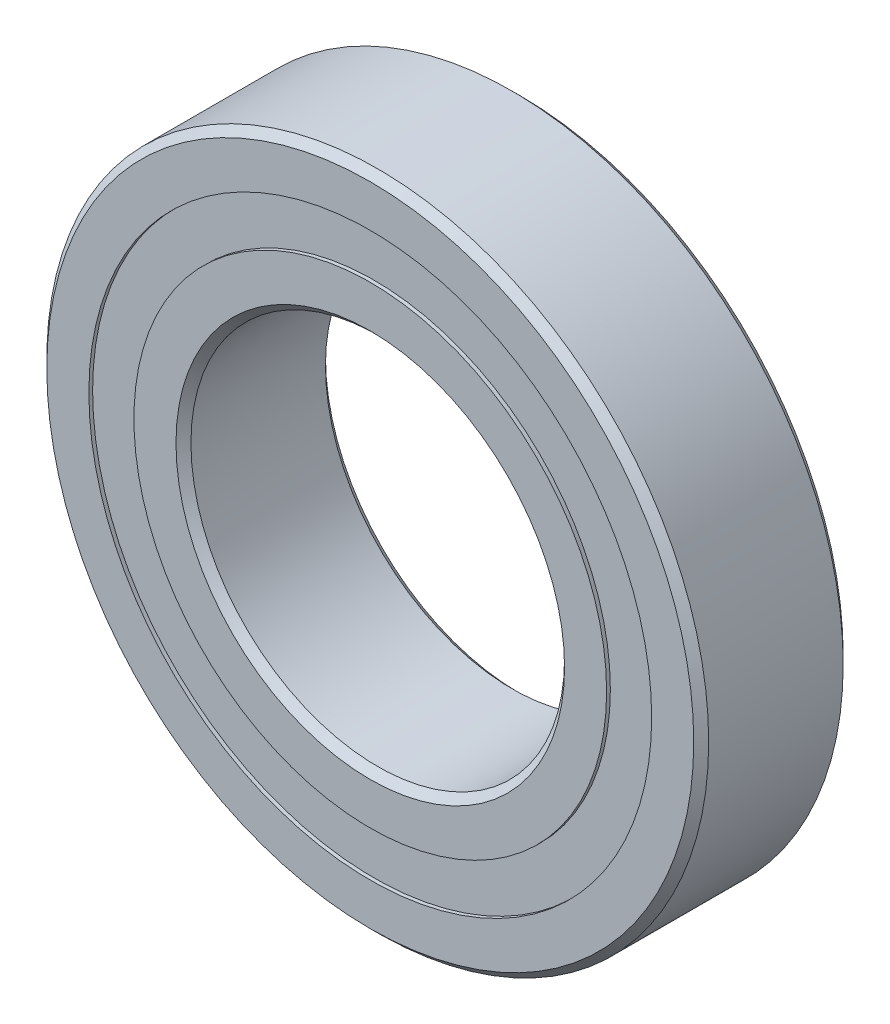
from build123d import *

# Parameters (mm, degrees)
CIRPATTERN1_COUNT = 12
SKETCH5_W         = 2.890924499
SKETCH5_H         = 4.21978022


with BuildPart() as part:
    # Sketch1 → Revolve1 (revolve)
    with BuildSketch(Plane(origin=(0, 0, 0), x_dir=(0, 0, -1), z_dir=(1, 0, 0))):
        with BuildLine():
            Line((6.3, 31), (-6.3, 31))
            Line((-6.3, 31), (-7, 30.3))
            Line((-7, 30.3), (-7, 26.35964011))
            Line((-7, 26.35964011), (-3.111111111, 26.35964011))
            ThreePointArc((-3.111111111, 26.35964011), (0, 28.008825501), (3.111111111, 26.35964011))
            Line((3.111111111, 26.35964011), (7, 26.35964011))
            Line((7, 26.35964011), (7, 30.3))
            Line((7, 30.3), (6.3, 31))
        make_face()
    revolve(axis=Axis((0, 0, 7), (0, 0, -1)))


with BuildPart() as body_2:
    # Sketch3 → Revolve3 (revolve)
    with BuildSketch(Plane(origin=(0, 0, 0), x_dir=(0, 0, -1), z_dir=(1, 0, 0))):
        with BuildLine():
            Line((-7, 22.13985989), (-3.111111111, 22.13985989))
            ThreePointArc((-3.111111111, 22.13985989), (0, 20.490674499), (3.111111111, 22.13985989))
            Line((3.111111111, 22.13985989), (7, 22.13985989))
            Line((7, 22.13985989), (7, 18.1995))
            Line((7, 18.1995), (6.3, 17.4995))
            Line((6.3, 17.4995), (-6.3, 17.4995))
            Line((-6.3, 17.4995), (-7, 18.1995))
            Line((-7, 18.1995), (-7, 22.13985989))
        make_face()
    revolve(axis=Axis((0, 0, 7), (0, 0, -1)))


with BuildPart() as body_3:
    # Sketch4 → Revolve4 (revolve)
    with BuildSketch(Plane(origin=(0, 0, 0), x_dir=(0, 0, -1), z_dir=(1, 0, 0))):
        with BuildLine():
            Line((-3.759075501, 24.24975), (3.759075501, 24.24975))
            ThreePointArc((3.759075501, 24.24975), (0, 28.008825501), (-3.759075501, 24.24975))
        make_face()
    revolve(axis=Axis((0, 24.24975, 3.759075501), (0, 0, -1)))


with BuildPart() as cirpattern1_1:
    # CirPattern1: pattern copy
    add(body_3.part.rotate(Axis((0, 0, -7), (0, 0, 1)), 1 * 360 / CIRPATTERN1_COUNT))


with BuildPart() as cirpattern1_2:
    # CirPattern1: pattern copy
    add(body_3.part.rotate(Axis((0, 0, -7), (0, 0, 1)), 2 * 360 / CIRPATTERN1_COUNT))


with BuildPart() as cirpattern1_3:
    # CirPattern1: pattern copy
    add(body_3.part.rotate(Axis((0, 0, -7), (0, 0, 1)), 3 * 360 / CIRPATTERN1_COUNT))


with BuildPart() as cirpattern1_4:
    # CirPattern1: pattern copy
    add(body_3.part.rotate(Axis((0, 0, -7), (0, 0, 1)), 4 * 360 / CIRPATTERN1_COUNT))


with BuildPart() as cirpattern1_5:
    # CirPattern1: pattern copy
    add(body_3.part.rotate(Axis((0, 0, -7), (0, 0, 1)), 5 * 360 / CIRPATTERN1_COUNT))


with BuildPart() as cirpattern1_6:
    # CirPattern1: pattern copy
    add(body_3.part.rotate(Axis((0, 0, -7), (0, 0, 1)), 6 * 360 / CIRPATTERN1_COUNT))


with BuildPart() as cirpattern1_7:
    # CirPattern1: pattern copy
    add(body_3.part.rotate(Axis((0, 0, -7), (0, 0, 1)), 7 * 360 / CIRPATTERN1_COUNT))


with BuildPart() as cirpattern1_8:
    # CirPattern1: pattern copy
    add(body_3.part.rotate(Axis((0, 0, -7), (0, 0, 1)), 8 * 360 / CIRPATTERN1_COUNT))


with BuildPart() as cirpattern1_9:
    # CirPattern1: pattern copy
    add(body_3.part.rotate(Axis((0, 0, -7), (0, 0, 1)), 9 * 360 / CIRPATTERN1_COUNT))


with BuildPart() as cirpattern1_10:
    # CirPattern1: pattern copy
    add(body_3.part.rotate(Axis((0, 0, -7), (0, 0, 1)), 10 * 360 / CIRPATTERN1_COUNT))


with BuildPart() as cirpattern1_11:
    # CirPattern1: pattern copy
    add(body_3.part.rotate(Axis((0, 0, -7), (0, 0, 1)), 11 * 360 / CIRPATTERN1_COUNT))


with BuildPart() as body_15:
    # Sketch5 → Revolve5 (revolve)
    with BuildSketch(Plane(origin=(0, 0, 0), x_dir=(0, 0, -1), z_dir=(1, 0, 0))):
        with Locations((-5.204537751, 24.24975)):
            Rectangle(SKETCH5_W, SKETCH5_H)
        with Locations((5.204537751, 24.24975)):
            Rectangle(SKETCH5_W, SKETCH5_H)
    revolve(axis=Axis((0, 0, 7), (0, 0, -1)))


solid = Compound([part.part, body_2.part, body_3.part, cirpattern1_1.part, cirpattern1_2.part, cirpattern1_3.part, cirpattern1_4.part, cirpattern1_5.part, cirpattern1_6.part, cirpattern1_7.part, cirpattern1_8.part, cirpattern1_9.part, cirpattern1_10.part, cirpattern1_11.part, body_15.part])
